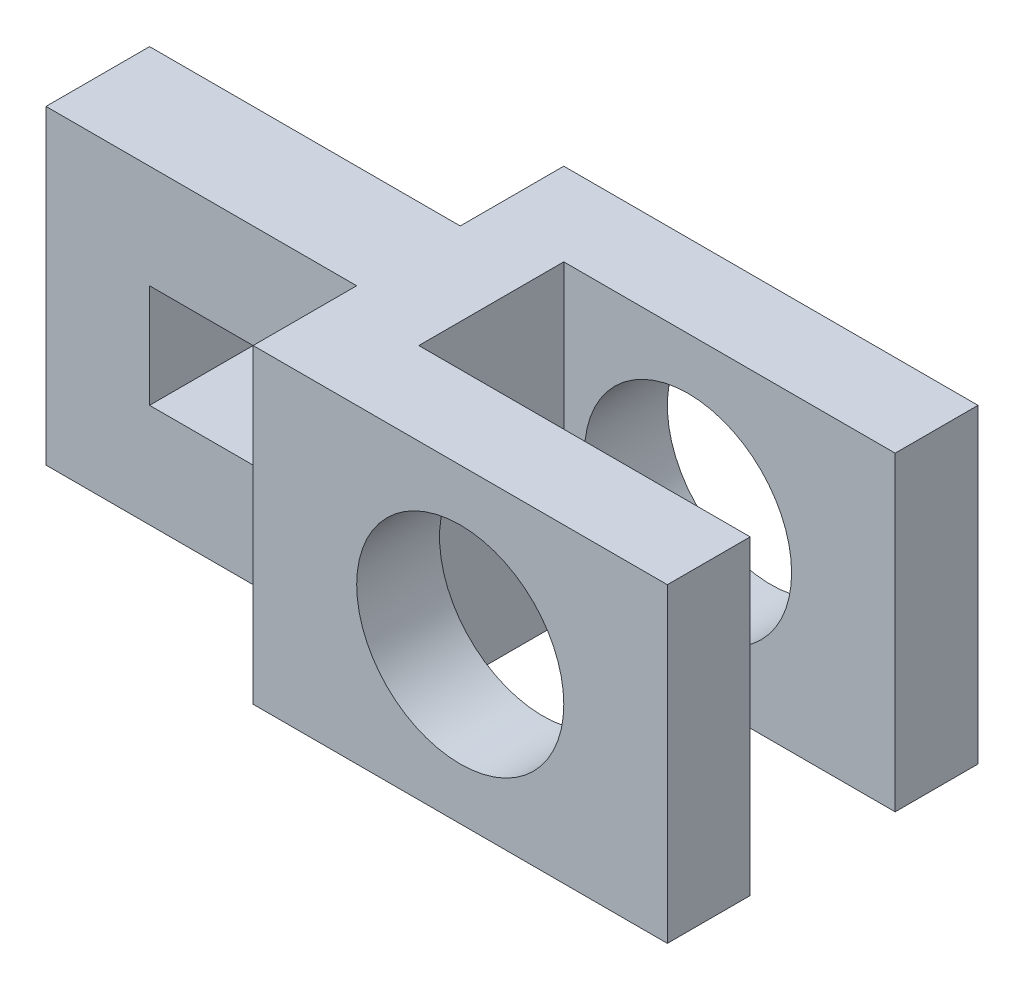
from build123d import *

# Parameters (mm, degrees)
EXTRUDE_1_DEPTH          = 30
CUT_EXTRUDE_1_DEPTH      = 74.890488337
CUT_EXTRUDE_1_DEPTH_BACK = 74.890488337
SKETCH_2_R               = 10
SKETCH_4_W               = 10
SKETCH_4_H               = 10
CUT_EXTRUDE_2_DEPTH      = 71.426335574


with BuildPart() as part:
    # 스케치1 → 보스-돌출1 (new body)
    with BuildSketch(Plane(origin=(0, 0, 0), x_dir=(1, 0, 0), z_dir=(0, 1, 0))):
        Polygon((-30.496316142, 3.867716008), (-30.496316142, 13.866104182), (-60.496316142, 13.866104182), (-60.496316142, 23.867716008), (-30.496316142, 23.867716008), (-30.496316142, 33.867716008), (9.503683858, 33.867716008), (9.503683858, 25.867716008), (-22.496316142, 25.867716008), (-22.496316142, 11.867716008), (9.503683858, 11.867716008), (9.503683858, 3.867716008), align=None)
    extrude(amount=EXTRUDE_1_DEPTH)

    # 스케치2 → 컷-돌출1 (cut, two sides: drawn at the far end of the back side and taken through both)
    with BuildSketch(Plane.XY.offset(-3.867716008).offset(-CUT_EXTRUDE_1_DEPTH_BACK)):
        with Locations((-10.496316142, 15)):
            Circle(SKETCH_2_R)
    extrude(amount=CUT_EXTRUDE_1_DEPTH + CUT_EXTRUDE_1_DEPTH_BACK, mode=Mode.SUBTRACT)

    # 스케치4 → 컷-돌출2 (cut, through all)
    with BuildSketch(Plane.XY.offset(-13.866104182)):
        with Locations((-45.496316142, 15)):
            Rectangle(SKETCH_4_W, SKETCH_4_H)
    extrude(amount=-CUT_EXTRUDE_2_DEPTH, mode=Mode.SUBTRACT)


solid = part.part
